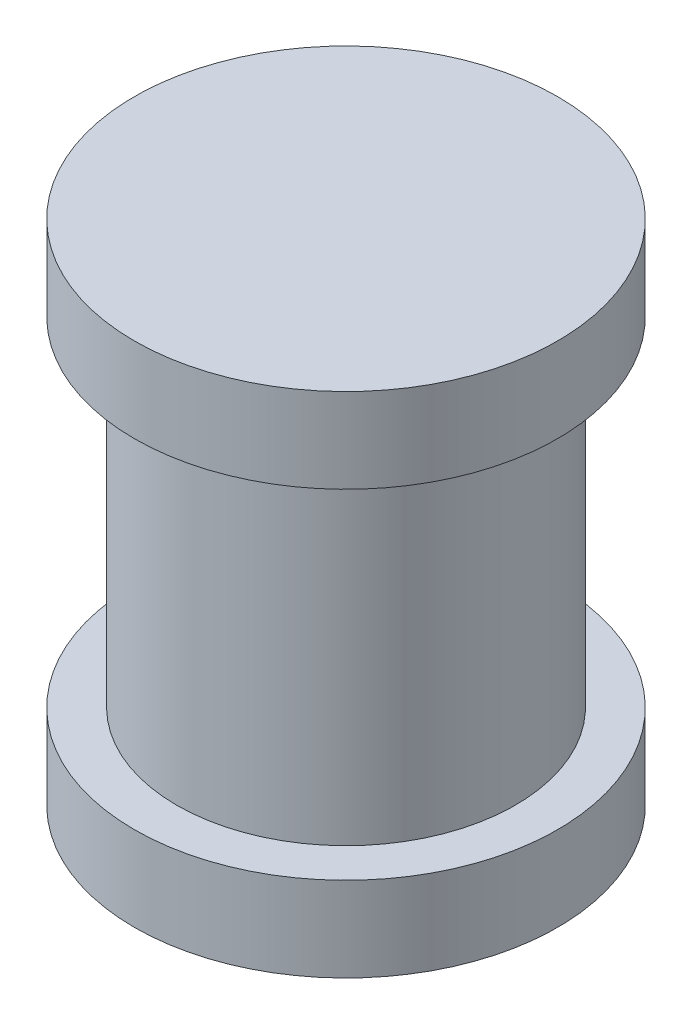
from build123d import *

# Parameters (mm, degrees)
SKETCH1_R           = 0.5
BOSS_EXTRUDE1_DEPTH = 1
SKETCH2_R           = 0.625
BOSS_EXTRUDE2_DEPTH = 0.25
BOSS_EXTRUDE3_START = 0.25
SKETCH3_R           = 0.625
BOSS_EXTRUDE3_DEPTH = 0.25


with BuildPart() as part:
    # Sketch1 → Boss-Extrude1 (new body)
    with BuildSketch(Plane(origin=(0, 0, 0), x_dir=(1, 0, 0), z_dir=(0, 1, 0))):
        with Locations(Location((0, 0, 0), (0, 0, 270))):
            Circle(SKETCH1_R)
    extrude(amount=BOSS_EXTRUDE1_DEPTH)

    # Sketch2 → Boss-Extrude2 (add)
    with BuildSketch(Plane(origin=(0, 0, 0), x_dir=(1, 0, 0), z_dir=(0, 1, 0))):
        with Locations(Location((0, 0, 0), (0, 0, 270))):
            Circle(SKETCH2_R)
    extrude(amount=-BOSS_EXTRUDE2_DEPTH)

    # Sketch3 → Boss-Extrude3 (add)
    with BuildSketch(Plane(origin=(0, 1, 0), x_dir=(1, 0, 0), z_dir=(0, 1, 0)).offset(BOSS_EXTRUDE3_START)):
        with Locations(Location((0, 0, 0), (0, 0, 270))):
            Circle(SKETCH3_R)
    extrude(amount=-BOSS_EXTRUDE3_DEPTH)


solid = part.part
